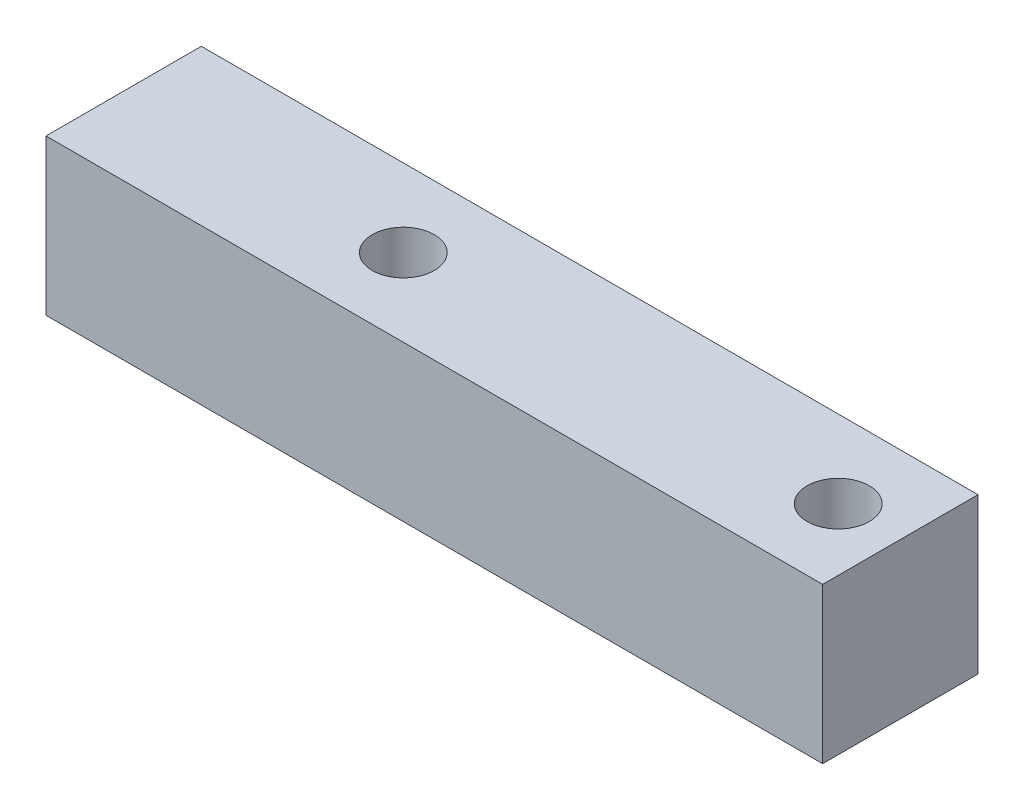
from build123d import *

# Parameters (mm, degrees)
SKETCH1_W           = 79.375
SKETCH1_H           = 15.875
BOSS_EXTRUDE1_DEPTH = 7.9375
SKETCH2_R           = 4.7625
CUT_EXTRUDE1_DEPTH  = 19.05
SKETCH3_R           = 3.175
CUT_EXTRUDE2_DEPTH  = 44.475478002


with BuildPart() as part:
    # Sketch1 → Boss-Extrude1 (new, symmetric)
    with BuildSketch(Plane.XY):
        Rectangle(SKETCH1_W, SKETCH1_H)
    extrude(amount=BOSS_EXTRUDE1_DEPTH, both=True)

    # Sketch2 → Cut-Extrude1 (cut)
    with BuildSketch(Plane.ZY.offset(39.6875)):
        Circle(SKETCH2_R)
    extrude(amount=-CUT_EXTRUDE1_DEPTH, mode=Mode.SUBTRACT)

    # Sketch3 → Cut-Extrude2 (cut, through all)
    with BuildSketch(Plane(origin=(0, 7.9375, 0), x_dir=(1, 0, 0), z_dir=(0, 1, 0))):
        with Locations(Location((33.3375, 0, 0), (0, 0, 180))):
            Circle(SKETCH3_R)
        with Locations(Location((-11.1125, 0, 0), (0, 0, 180))):
            Circle(SKETCH3_R)
    extrude(amount=-CUT_EXTRUDE2_DEPTH, mode=Mode.SUBTRACT)


solid = part.part
